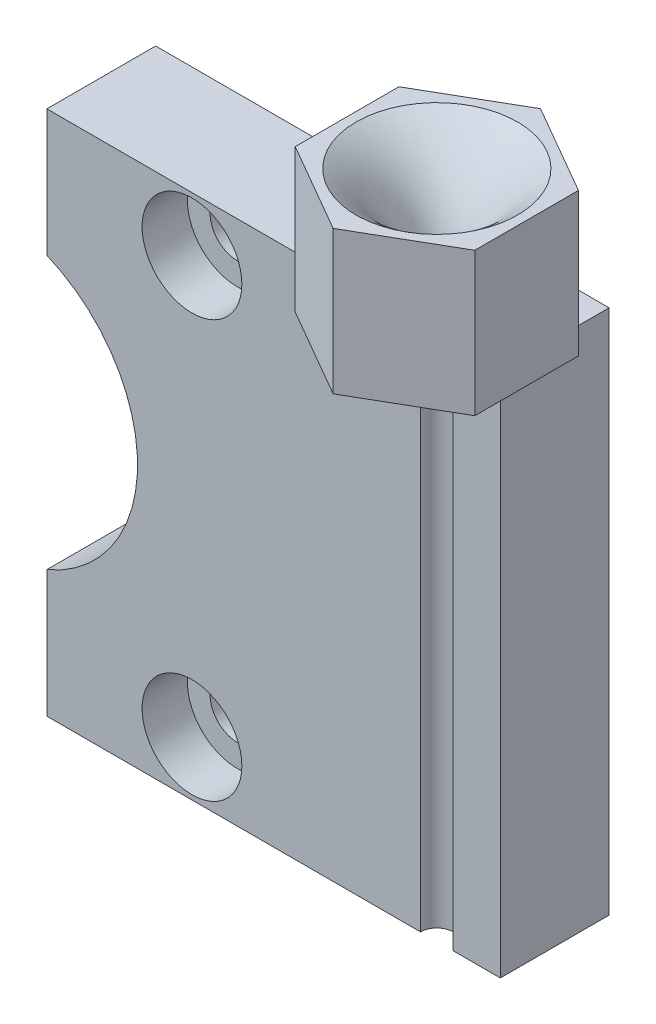
from build123d import *

# Parameters (mm, degrees)
SKETCH1_R                       = 1.5
BOSS_EXTRUDE1_DEPTH             = 6
SKETCH2_R                       = 0.9
CUT_EXTRUDE1_DEPTH              = 35.146742158
BOSS_EXTRUDE2_START             = 7.9
SKETCH3_R                       = 0.9
BOSS_EXTRUDE2_DEPTH             = 7.9
CBORE_FOR_M2_5_SHCS1_AT_2_COUNT = 2
CBORE_FOR_M2_5_SHCS1_AT_2_PITCH = 23
CBORE_FOR_M2_5_SHCS1_AT_3_COUNT = 2
CBORE_FOR_M2_5_SHCS1_AT_3_PITCH = 23
BOSS_EXTRUDE3_START             = 1
SKETCH8_R                       = 2
SKETCH8_R_2                     = 1.5
BOSS_EXTRUDE3_DEPTH             = 1


with BuildPart() as part:
    # Sketch1 → Boss-Extrude1 (new body)
    with BuildSketch(Plane.XY):
        with BuildLine():
            Line((17, 14.5), (-8, 14.5))
            Line((-8, 14.5), (-8, 7.5))
            ThreePointArc((-8, 7.5), (-3, 0), (-8, -7.5))
            Line((-8, -7.5), (-8, -14.5))
            Line((-8, -14.5), (17, -14.5))
            Line((17, -14.5), (17, 14.5))
        make_face()
        with Locations((0, 11.5)):
            Circle(SKETCH1_R, mode=Mode.SUBTRACT)
        with Locations((0, -11.5)):
            Circle(SKETCH1_R, mode=Mode.SUBTRACT)
    extrude(amount=BOSS_EXTRUDE1_DEPTH)

    # Sketch2 → Cut-Extrude1 (cut, through all)
    with BuildSketch(Plane(origin=(0, 14.5, 0), x_dir=(1, 0, 0), z_dir=(0, 1, 0))):
        with Locations((13.5, -6)):
            Circle(SKETCH2_R)
    extrude(amount=-CUT_EXTRUDE1_DEPTH, mode=Mode.SUBTRACT)

    # Sketch3 → Boss-Extrude2 (add)
    with BuildSketch(Plane(origin=(0, 14.5, 0), x_dir=(1, 0, 0), z_dir=(0, 1, 0)).offset(BOSS_EXTRUDE2_START)):
        Polygon((13.5, -0.284232335), (8.55, -3.142116168), (8.55, -8.857883832), (13.5, -11.715767665), (18.45, -8.857883832), (18.45, -3.142116168), align=None)
        with Locations(Location((13.5, -6, 0), (0, 0, 270))):
            Circle(SKETCH3_R, mode=Mode.SUBTRACT)
    extrude(amount=-BOSS_EXTRUDE2_DEPTH)

    # Sketch6 → Cut-Revolve1 (revolve, cut)
    with BuildSketch(Plane(origin=(5.973076211, 0, 10.345671476), x_dir=(0.8660254037844388, 0, -0.49999999999999983), z_dir=(0.4999999999999998, 0, 0.8660254037844387)), mode=Mode.PRIVATE) as cut_revolve1_sk:
        with BuildLine():
            Line((9.591342951, 22.4), (9.591342951, 16.4))
            ThreePointArc((9.591342951, 16.4), (10.678390575, 19.807038489), (13.141342951, 22.4))
            Line((13.141342951, 22.4), (9.591342951, 22.4))
        make_face()
    revolve(cut_revolve1_sk.sketch.rotate(Axis((13.5, 22.4, 6), (0, -1, 0)), 210), axis=Axis((13.5, 22.4, 6), (0, -1, 0)), mode=Mode.SUBTRACT)

    # Sketch7 → CBORE for M2.5 SHCS1 (revolve, cut)
    with BuildSketch(Plane(origin=(0, -11.5, 6), x_dir=(0, -1, 0), z_dir=(1, 0, 0))):
        Polygon((0, 0), (0, 6), (1.45, 6), (1.45, 2.5), (2.75, 2.5), (2.75, 0), align=None)
    cbore_for_m2_5_shcs1 = revolve(axis=Axis((0, -11.5, 12.35), (0, 0, -1)), mode=Mode.SUBTRACT)

    # CBORE for M2.5 SHCS1 at 2: CBORE for M2.5 SHCS1 ×2
    with Locations(*[(0, i * CBORE_FOR_M2_5_SHCS1_AT_2_PITCH, 0) for i in range(1, CBORE_FOR_M2_5_SHCS1_AT_2_COUNT)]):
        add(cbore_for_m2_5_shcs1, mode=Mode.SUBTRACT)

    # CBORE for M2.5 SHCS1 at 3: CBORE for M2.5 SHCS1 ×2
    with Locations(*[(0, i * CBORE_FOR_M2_5_SHCS1_AT_3_PITCH, 0) for i in range(1, CBORE_FOR_M2_5_SHCS1_AT_3_COUNT)]):
        add(cbore_for_m2_5_shcs1, mode=Mode.SUBTRACT)

    # Sketch8 → Boss-Extrude3 (add)
    # profile 1 of 2: a face of its own
    with BuildSketch(Plane(origin=(0, 0, 0), x_dir=(-1, 0, 0), z_dir=(0, 0, -1)).offset(BOSS_EXTRUDE3_START)):
        with Locations((0, 11.5)):
            Circle(SKETCH8_R)
        with Locations((0, 11.5)):
            Circle(SKETCH8_R_2, mode=Mode.SUBTRACT)
    # profile 2 of 2: a face of its own
    with BuildSketch(Plane(origin=(0, 0, 0), x_dir=(-1, 0, 0), z_dir=(0, 0, -1)).offset(BOSS_EXTRUDE3_START)):
        with Locations((0, -11.5)):
            Circle(SKETCH8_R)
        with Locations((0, -11.5)):
            Circle(SKETCH8_R_2, mode=Mode.SUBTRACT)
    extrude(amount=-BOSS_EXTRUDE3_DEPTH)


solid = part.part
